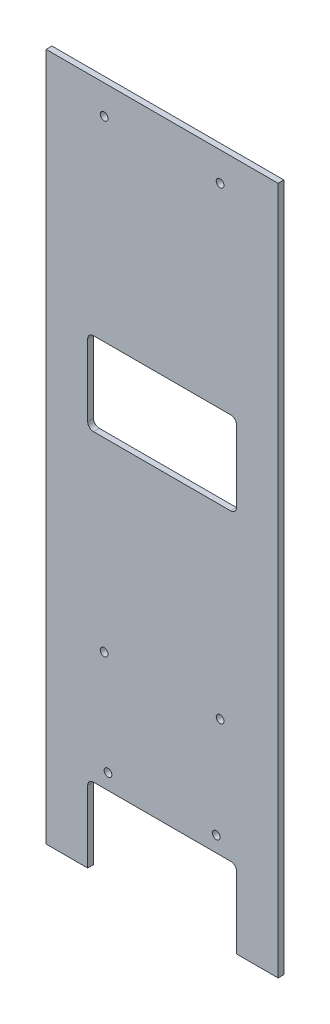
from build123d import *

# Parameters (mm, degrees)
SKETCH1_W           = 120
SKETCH1_H           = 400
BOSS_EXTRUDE1_DEPTH = 3
CUT_EXTRUDE1_DEPTH  = 3
SKETCH3_R           = 2
CUT_EXTRUDE2_DEPTH  = 3
SKETCH4_W           = 120
SKETCH4_H           = 44
CUT_EXTRUDE3_DEPTH  = 10
SKETCH5_R           = 2
CUT_EXTRUDE4_DEPTH  = 10


with BuildPart() as part:
    # Sketch1 → Boss-Extrude1 (new body)
    with BuildSketch(Plane.XY):
        Rectangle(SKETCH1_W, SKETCH1_H)
    extrude(amount=BOSS_EXTRUDE1_DEPTH)

    # Sketch2 → Cut-Extrude1 (cut)
    with BuildSketch(Plane.XY.offset(3)):
        with BuildLine():
            Line((-35.5, -116), (35.5, -116))
            ThreePointArc((35.5, -116), (37.621320344, -116.878679656), (38.5, -119))
            Line((38.5, -119), (38.5, -156))
            ThreePointArc((38.5, -156), (37.621320344, -158.121320344), (35.5, -159))
            Line((35.5, -159), (-35.5, -159))
            ThreePointArc((-35.5, -159), (-37.621320344, -158.121320344), (-38.5, -156))
            Line((-38.5, -156), (-38.5, -119))
            ThreePointArc((-38.5, -119), (-37.621320344, -116.878679656), (-35.5, -116))
        make_face()
        with BuildLine():
            Line((-35.5, 84), (35.5, 84))
            ThreePointArc((35.5, 84), (37.621320344, 83.121320344), (38.5, 81))
            Line((38.5, 81), (38.5, 44))
            ThreePointArc((38.5, 44), (37.621320344, 41.878679656), (35.5, 41))
            Line((35.5, 41), (-35.5, 41))
            ThreePointArc((-35.5, 41), (-37.621320344, 41.878679656), (-38.5, 44))
            Line((-38.5, 44), (-38.5, 81))
            ThreePointArc((-38.5, 81), (-37.621320344, 83.121320344), (-35.5, 84))
        make_face()
    extrude(amount=-CUT_EXTRUDE1_DEPTH, mode=Mode.SUBTRACT)

    # Sketch3 → Cut-Extrude2 (cut)
    with BuildSketch(Plane.XY.offset(3)):
        with Locations((-30, 185)):
            Circle(SKETCH3_R)
        with Locations((-30, 65)):
            Circle(SKETCH3_R)
        with Locations((-30, -55)):
            Circle(SKETCH3_R)
        with Locations((-30, -175)):
            Circle(SKETCH3_R)
        with Locations(Location((30, -175, 0), (0, 0, 180))):
            Circle(SKETCH3_R)
        with Locations(Location((30, -55, 0), (0, 0, 180))):
            Circle(SKETCH3_R)
        with Locations((30, 65)):
            Circle(SKETCH3_R)
        with Locations(Location((30, 185, 0), (0, 0, 180))):
            Circle(SKETCH3_R)
    extrude(amount=-CUT_EXTRUDE2_DEPTH, mode=Mode.SUBTRACT)

    # Sketch4 → Cut-Extrude3 (cut)
    with BuildSketch(Plane.XY.offset(3)):
        with Locations((0, -178)):
            Rectangle(SKETCH4_W, SKETCH4_H)
    extrude(amount=-CUT_EXTRUDE3_DEPTH, mode=Mode.SUBTRACT)

    # Sketch5 → Cut-Extrude4 (cut)
    with BuildSketch(Plane.XY.offset(3)):
        with Locations((-28, -108)):
            Circle(SKETCH5_R)
        with Locations((28, -108)):
            Circle(SKETCH5_R)
    extrude(amount=-CUT_EXTRUDE4_DEPTH, mode=Mode.SUBTRACT)


solid = part.part
